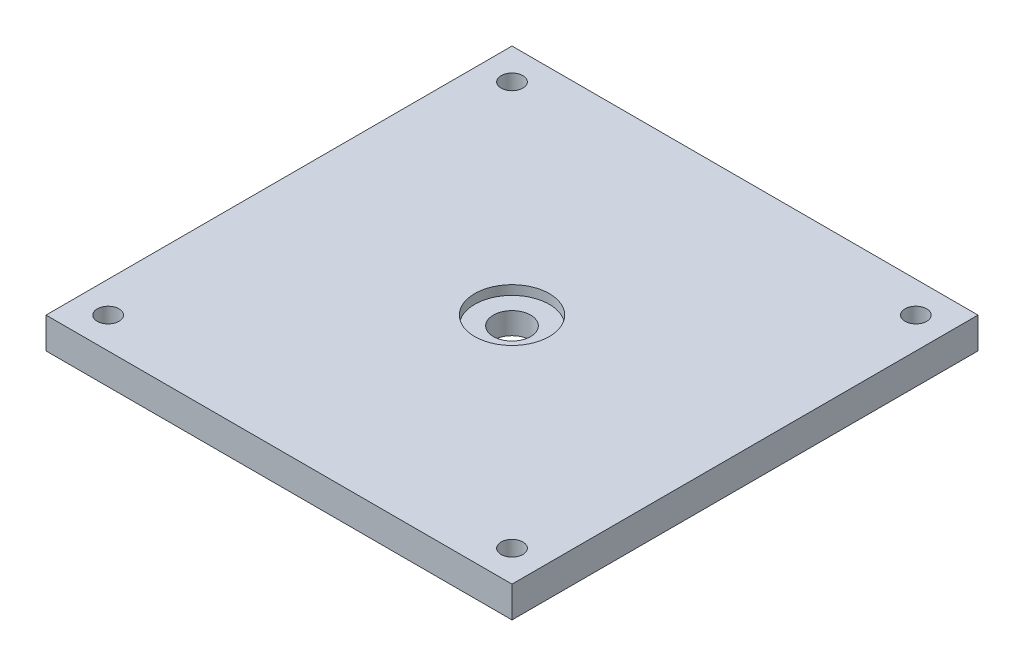
from build123d import *

# Parameters (mm, degrees)
SKETCH1_W               = 150
SKETCH1_H               = 150
BOSS_EXTRUDE1_DEPTH     = 10
SKETCH2_R               = 12
CUT_EXTRUDE1_DEPTH      = 3
SKETCH3_R               = 6
CUT_EXTRUDE2_DEPTH      = 7
HOLE1_D                 = 7
M2_5_TAPPED_HOLE1_D     = 2.05
M2_5_TAPPED_HOLE1_DEPTH = 5.35
M2_5_TAPPED_HOLE1_TIP   = 0.615882135


with BuildPart() as part:
    # Sketch1 → Boss-Extrude1 (new body)
    with BuildSketch(Plane(origin=(0, 0, 0), x_dir=(1, 0, 0), z_dir=(0, 1, 0))):
        Rectangle(SKETCH1_W, SKETCH1_H)
    extrude(amount=BOSS_EXTRUDE1_DEPTH)

    # Sketch2 → Cut-Extrude1 (cut)
    with BuildSketch(Plane(origin=(0, 10, 0), x_dir=(1, 0, 0), z_dir=(0, 1, 0))):
        with Locations(Location((0, 0, 0), (0, 0, 270))):
            Circle(SKETCH2_R)
    extrude(amount=-CUT_EXTRUDE1_DEPTH, mode=Mode.SUBTRACT)

    # Sketch3 → Cut-Extrude2 (cut)
    with BuildSketch(Plane(origin=(0, 7, 0), x_dir=(1, 0, 0), z_dir=(0, 1, 0))):
        with Locations(Location((0, 0, 0), (0, 0, 270))):
            Circle(SKETCH3_R)
    extrude(amount=-CUT_EXTRUDE2_DEPTH, mode=Mode.SUBTRACT)

    # Hole1 (through all)
    with Locations(Plane(origin=(65, 0, 65), x_dir=(0, 0, -1), z_dir=(0, -1, 0))):
        with Locations((0, 0), (130, 0), (130, -130), (0, -130)):
            Hole(HOLE1_D / 2)

    # M2.5 Tapped Hole1
    with Locations(Plane(origin=(-9.525, 0, 0), x_dir=(0, 0, -1), z_dir=(0, -1, 0))):
        with Locations((0, 0), (0, 19.05)):
            Hole(M2_5_TAPPED_HOLE1_D / 2, depth=M2_5_TAPPED_HOLE1_DEPTH)
            with Locations((0, 0, -(M2_5_TAPPED_HOLE1_DEPTH + M2_5_TAPPED_HOLE1_TIP / 2))):  # 118° drill point
                Cone(0, M2_5_TAPPED_HOLE1_D / 2, M2_5_TAPPED_HOLE1_TIP, mode=Mode.SUBTRACT)


solid = part.part
